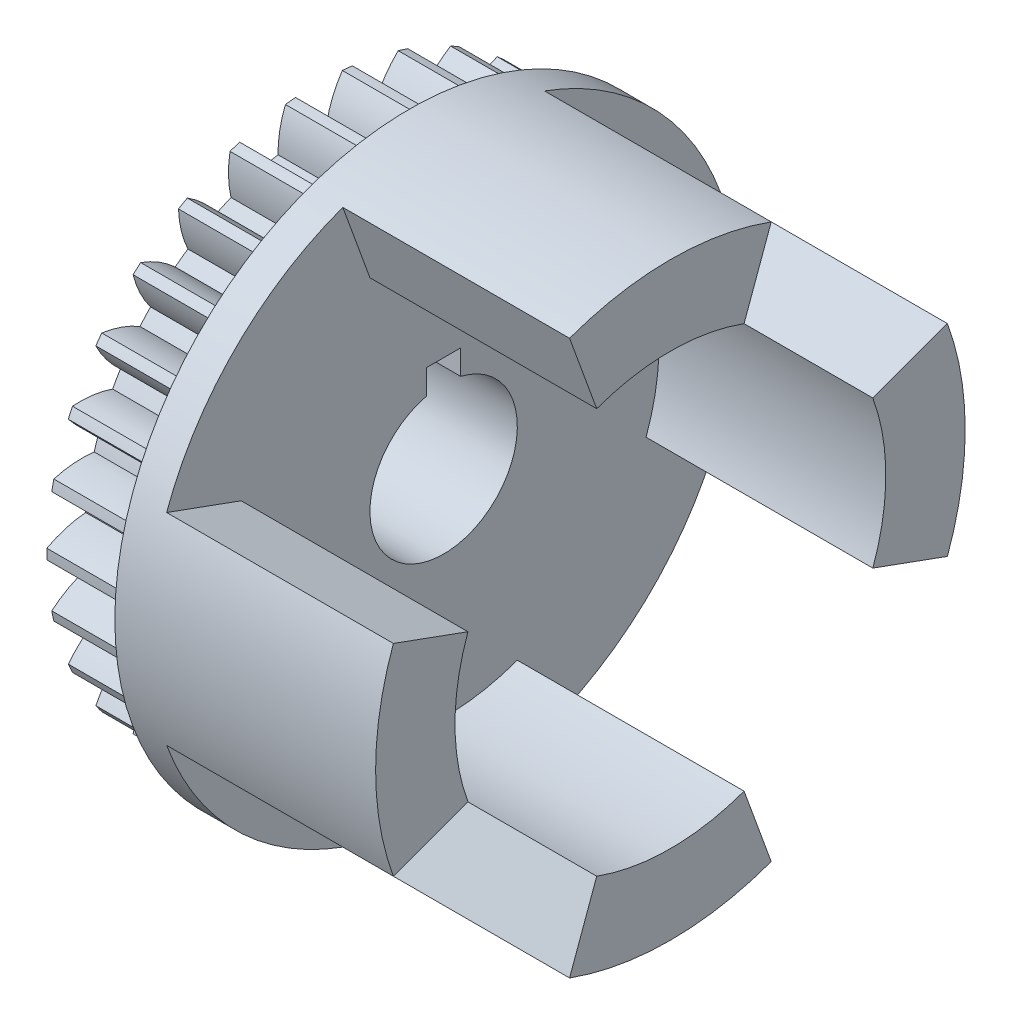
from build123d import *
from build123d.topology import SkipClean

# Parameters (mm, degrees)
BASPROSKE_W         = 8
BASPROSKE_H         = 24
TOOTHCUT_DEPTH      = 35.871191548
TEETHCUTS_COUNT     = 30
TEETHCUTS_ANGLE     = 348
BORSKE_R            = 2
BORE_DEPTH          = 50.0000508
SKETCH_1_R          = 26
EXTRUDE_1_DEPTH     = 3
EXTRUDE_2_DEPTH     = 20
CUT_EXTRUDE_1_DEPTH = 42.856899073


with BuildPart() as part:
    # BasProSke → Base-Revolve (revolve)
    with BuildSketch(Plane(origin=(0, 0, 0), x_dir=(1, 0, 0), z_dir=(0, 1, 0)), mode=Mode.PRIVATE) as base_revolve_sk:
        with Locations((4, 12)):
            Rectangle(BASPROSKE_W, BASPROSKE_H)
    revolve(base_revolve_sk.sketch.rotate(Axis((-10, 0, 0), (1, 0, 0)), 180), axis=Axis((-10, 0, 0), (1, 0, 0)))

    # TooCutSke → ToothCut (cut, through all)
    with BuildSketch(Plane(origin=(0, 0, 0), x_dir=(0, 0, -1), z_dir=(1, 0, 0))):
        with BuildLine():
            ThreePointArc((0.693278797, 20.612344372), (0, 20.624), (-0.693278797, 20.612344372))
            ThreePointArc((-0.693278797, 20.612344372), (-1.219042225, 22.34383125), (-2.080549663, 23.935144835))
            ThreePointArc((-2.080549663, 23.935144835), (0, 24.0254), (2.080549663, 23.935144835))
            ThreePointArc((2.080549663, 23.935144835), (1.219042225, 22.34383125), (0.693278797, 20.612344372))
        make_face()
    toothcut = extrude(amount=TOOTHCUT_DEPTH, mode=Mode.SUBTRACT)

    # TeethCuts: ToothCut ×30 about axis
    teethcuts_axis = Axis((-10, 0, 0), (1, 0, 0))
    for i in range(1, TEETHCUTS_COUNT):
        add(toothcut.rotate(teethcuts_axis, i * TEETHCUTS_ANGLE / (TEETHCUTS_COUNT - 1)), mode=Mode.SUBTRACT)

    # BorSke → Bore (cut, symmetric)
    with BuildSketch(Plane(origin=(0, 0, 0), x_dir=(0, 0, -1), z_dir=(1, 0, 0))):
        with Locations(Location((0, 0, 0), (0, 0, 180))):
            Circle(BORSKE_R)
    extrude(amount=BORE_DEPTH, both=True, mode=Mode.SUBTRACT)

    # 草图1 → 凸台-拉伸1 (add)
    with BuildSketch(Plane(origin=(8, 0, 0), x_dir=(0, 0, -1), z_dir=(1, 0, 0))):
        Circle(SKETCH_1_R)
    extrude(amount=EXTRUDE_1_DEPTH)

    # 草图2 → 凸台-拉伸2 (add)
    with SkipClean():  # the faces are left unmerged after this step: merging them gives an invalid solid
        with BuildSketch(Plane(origin=(11, 0, 0), x_dir=(0, 0, -1), z_dir=(1, 0, 0))):
            with BuildLine():
                Line((-6.498382723, 17.854159795), (-8.892523726, 24.43200814))
                ThreePointArc((-8.892523726, 24.43200814), (0, 26), (8.892523726, 24.43200814))
                Line((8.892523726, 24.43200814), (6.498382723, 17.854159795))
                ThreePointArc((6.498382723, 17.854159795), (0, 19), (-6.498382723, 17.854159795))
            make_face()
            with BuildLine():
                Line((17.854159795, -6.498382723), (24.43200814, -8.892523726))
                ThreePointArc((24.43200814, -8.892523726), (26, 0), (24.43200814, 8.892523726))
                Line((24.43200814, 8.892523726), (17.854159795, 6.498382723))
                ThreePointArc((17.854159795, 6.498382723), (19, 0), (17.854159795, -6.498382723))
            make_face()
            with BuildLine():
                Line((-6.498382723, -17.854159795), (-8.892523726, -24.43200814))
                ThreePointArc((-8.892523726, -24.43200814), (0, -26), (8.892523726, -24.43200814))
                Line((8.892523726, -24.43200814), (6.498382723, -17.854159795))
                ThreePointArc((6.498382723, -17.854159795), (0, -19), (-6.498382723, -17.854159795))
            make_face()
            with BuildLine():
                Line((-17.854159795, 6.498382723), (-24.43200814, 8.892523726))
                ThreePointArc((-24.43200814, 8.892523726), (-26, 0), (-24.43200814, -8.892523726))
                Line((-24.43200814, -8.892523726), (-17.854159795, -6.498382723))
                ThreePointArc((-17.854159795, -6.498382723), (-19, 0), (-17.854159795, 6.498382723))
            make_face()
        extrude(amount=EXTRUDE_2_DEPTH)

    # 草图3 → 切除-拉伸1 (cut, through all)
    with SkipClean():  # the faces are left unmerged after this step: merging them gives an invalid solid
        with BuildSketch(Plane(origin=(11, 0, 0), x_dir=(0, 0, -1), z_dir=(1, 0, 0))):
            with BuildLine():
                Line((-1.5, 6.32455532), (-1.5, 8.5))
                Line((-1.5, 8.5), (1.5, 8.5))
                Line((1.5, 8.5), (1.5, 6.32455532))
                ThreePointArc((1.5, 6.32455532), (0, -6.5), (-1.5, 6.32455532))
            make_face()
        extrude(amount=-CUT_EXTRUDE_1_DEPTH, mode=Mode.SUBTRACT)


solid = part.part
